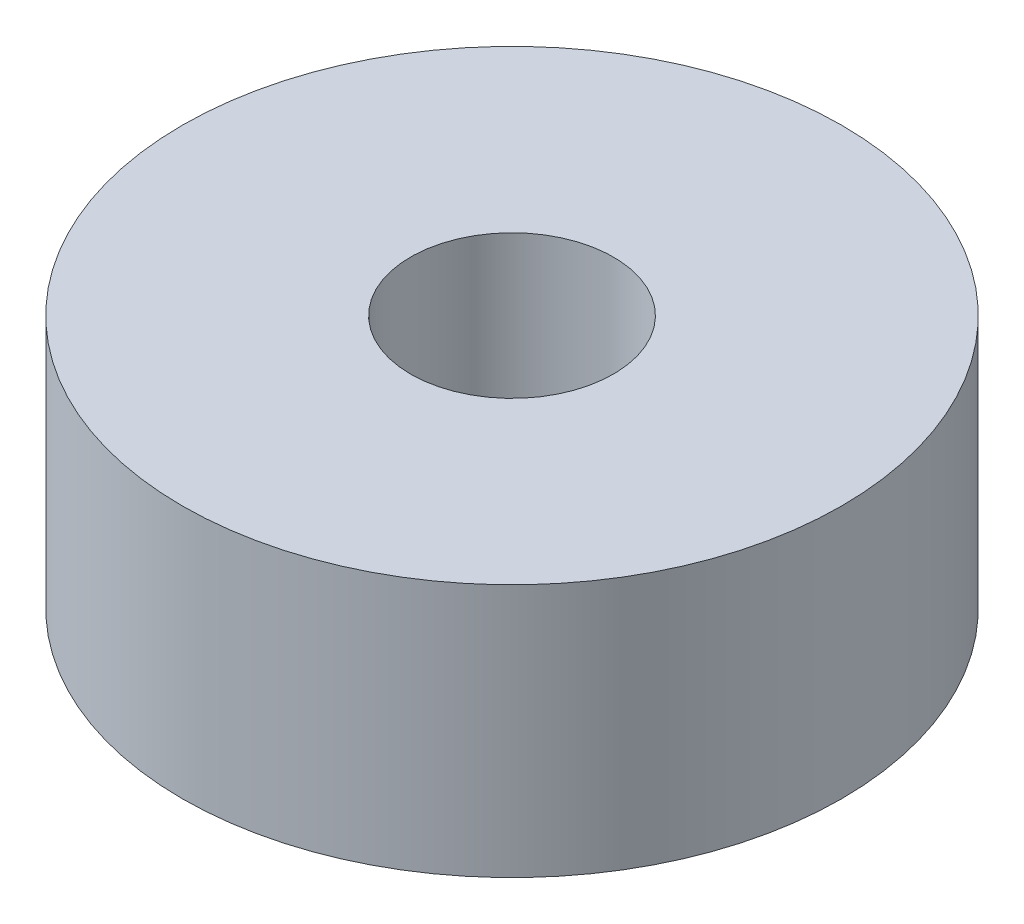
from build123d import *

# Parameters (mm, degrees)
SKETCH1_R           = 6.5
SKETCH1_R_2         = 2
BOSS_EXTRUDE3_DEPTH = 5


with BuildPart() as part:
    # Sketch1 → Boss-Extrude3 (new body)
    with BuildSketch(Plane(origin=(0, 0, 0), x_dir=(1, 0, 0), z_dir=(0, 1, 0))):
        with Locations(Location((0, 0, 0), (0, 0, 270))):
            Circle(SKETCH1_R)
        with Locations(Location((0, 0, 0), (0, 0, 270))):
            Circle(SKETCH1_R_2, mode=Mode.SUBTRACT)
    extrude(amount=BOSS_EXTRUDE3_DEPTH)


solid = part.part
